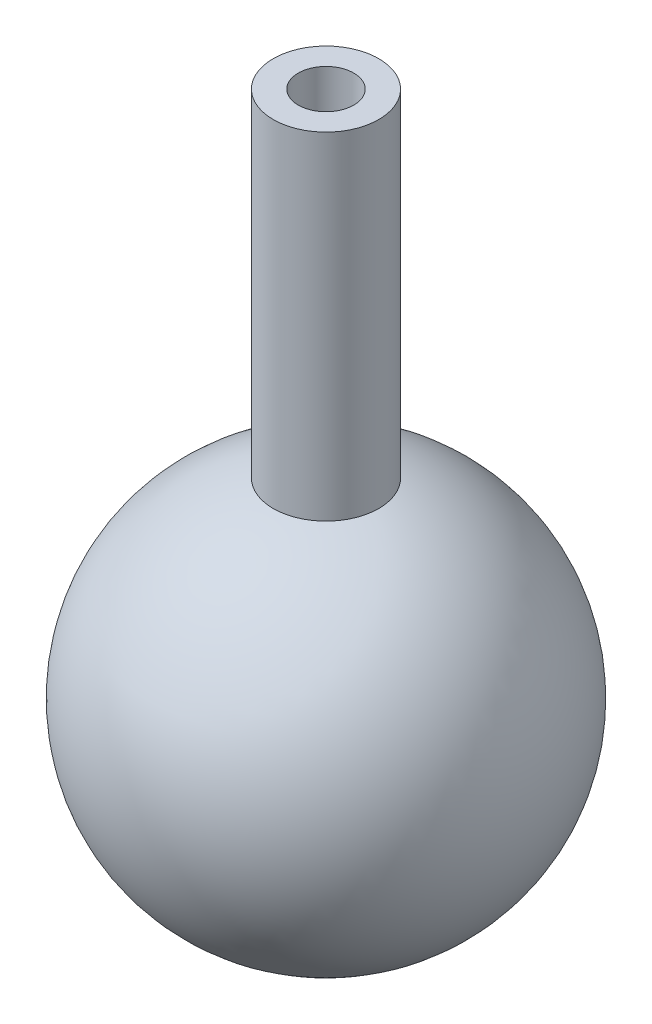
from build123d import *

# Parameters (mm, degrees)
BOSS_EXTRUDE1_DEPTH      = 50
BOSS_EXTRUDE1_DEPTH_BACK = 10
SKETCH2_R                = 8
SKETCH4_R                = 4.21
CUT_EXTRUDE3_DEPTH       = 50


with BuildPart() as part:
    # Sketch1 → Revolve1 (revolve)
    with BuildSketch(Plane(origin=(0, 0, 0), x_dir=(1, 0, 0), z_dir=(0, 1, 0))):
        with BuildLine():
            Line((0, 30), (0, -30))
            ThreePointArc((0, -30), (30, 0), (0, 30))
        make_face()
    revolve(axis=Axis((0, 0, -30), (0, 0, 1)))

    # Sketch2 → Boss-Extrude1 (add, two sides: drawn at the far end of the back side and taken through both)
    with BuildSketch(Plane(origin=(0, 30, 0), x_dir=(1, 0, 0), z_dir=(0, 1, 0)).offset(-BOSS_EXTRUDE1_DEPTH_BACK)):
        with Locations(Location((0, 0, 0), (0, 0, 270))):
            Circle(SKETCH2_R)
    extrude(amount=BOSS_EXTRUDE1_DEPTH + BOSS_EXTRUDE1_DEPTH_BACK)

    # Sketch4 → Cut-Extrude3 (cut)
    with BuildSketch(Plane(origin=(0, 80, 0), x_dir=(1, 0, 0), z_dir=(0, 1, 0))):
        with Locations(Location((0, 0, 0), (0, 0, 270))):
            Circle(SKETCH4_R)
    extrude(amount=-CUT_EXTRUDE3_DEPTH, mode=Mode.SUBTRACT)


solid = part.part
